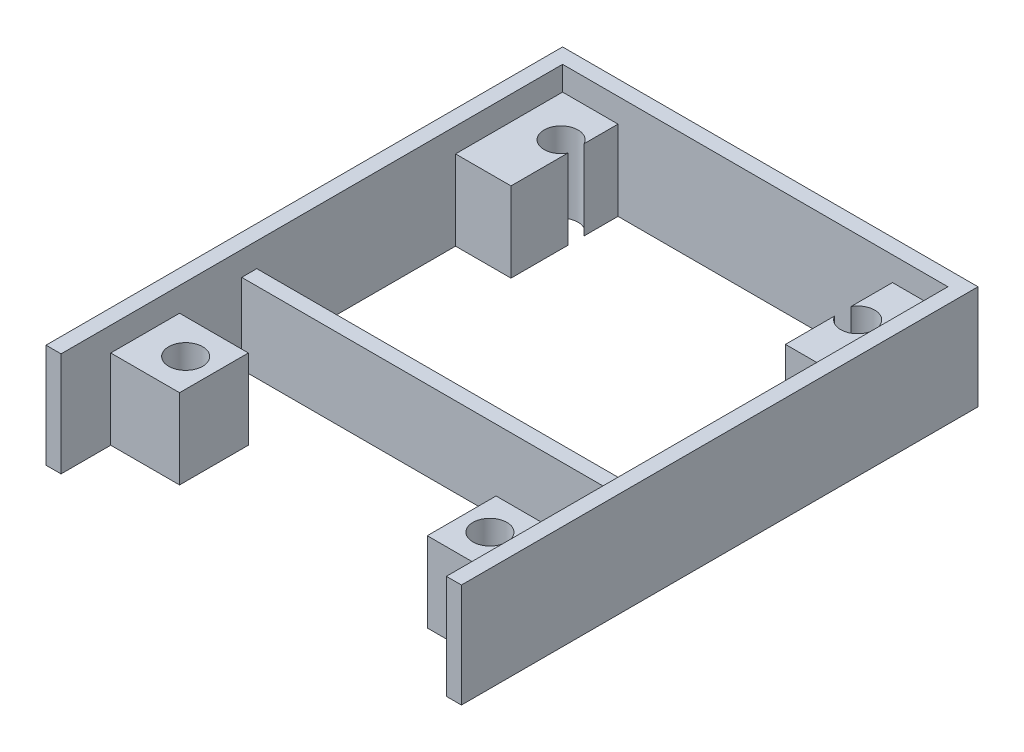
from build123d import *

# Parameters (mm, degrees)
SKETCH1_W            = 27.6032
SKETCH1_H            = 35.3248
SKETCH1_W_2          = 25.6032
SKETCH1_H_2          = 33.3248
MAINCASING_DEPTH     = 12.93
SKETCH2_W            = 6.35
SKETCH2_H            = 9.525
SKETCH2_R            = 1.4732
MOUNTINGTABS_DEPTH   = 1.5875
SKETCH3_W            = 3.683
SKETCH3_H            = 7.112
SKETCH3_W_2          = 4.572
SKETCH3_H_2          = 4.572
SKETCH3_R            = 1.1303
BOSS_EXTRUDE3_DEPTH  = 12.93
SKETCH4_W            = 27.6032
SKETCH4_H            = 35.3248
SKETCH4_W_2          = 25.6032
SKETCH4_H_2          = 33.3248
BOSS_EXTRUDE4_DEPTH  = 1.6002
SKETCH5_R            = 1.1303
UPPERHOLES_DEPTH     = 38.848662667
SKETCH6_W            = 25.6032
SKETCH6_H            = 1
BOSS_EXTRUDE5_DEPTH  = 12.93
SKETCH7_W            = 27.6032
SKETCH7_H            = 1
CUT_EXTRUDE2_DEPTH   = 38.848662667
SKETCH8_W            = 47.196128447
SKETCH8_H            = 36.476203794
TEMPMATREMOVAL_DEPTH = 7.62


with BuildPart() as part:
    # Sketch1 → mainCasing (new body)
    with BuildSketch(Plane(origin=(0, 0, 0), x_dir=(1, 0, 0), z_dir=(0, 1, 0))):
        with Locations((2.873828571, -8.628742857)):
            Rectangle(SKETCH1_W, SKETCH1_H)
        with Locations((2.873828571, -8.628742857)):
            Rectangle(SKETCH1_W_2, SKETCH1_H_2, mode=Mode.SUBTRACT)
    extrude(amount=-MAINCASING_DEPTH)

    # Sketch2 → mountingTabs (add)
    # profile 1 of 2: a face of its own
    with BuildSketch(Plane.XZ.offset(12.93)):
        with Locations((-14.102771429, 8.628742857)):
            Rectangle(SKETCH2_W, SKETCH2_H)
        with Locations(Location((-14.102771429, 8.628742857, 0), (0, 0, 270))):
            Circle(SKETCH2_R, mode=Mode.SUBTRACT)
    # profile 2 of 2: a face of its own
    with BuildSketch(Plane.XZ.offset(12.93)):
        with Locations((19.850428571, 8.628742857)):
            Rectangle(SKETCH2_W, SKETCH2_H)
        with Locations(Location((19.850428571, 8.628742857, 0), (0, 0, 270))):
            Circle(SKETCH2_R, mode=Mode.SUBTRACT)
    extrude(amount=-MOUNTINGTABS_DEPTH)

    # Sketch3 → Boss-Extrude3 (add)
    # profile 1 of 4: a face of its own
    with BuildSketch(Plane(origin=(0, 0, 0), x_dir=(1, 0, 0), z_dir=(0, 1, 0))):
        with Locations((-8.086271429, 4.477657143)):
            Rectangle(SKETCH3_W, SKETCH3_H)
    # profile 2 of 4: a face of its own
    with BuildSketch(Plane(origin=(0, 0, 0), x_dir=(1, 0, 0), z_dir=(0, 1, 0))):
        with Locations((13.833928571, 4.477657143)):
            Rectangle(SKETCH3_W, SKETCH3_H)
    # profile 3 of 4: a face of its own
    with BuildSketch(Plane(origin=(0, 0, 0), x_dir=(1, 0, 0), z_dir=(0, 1, 0))):
        with Locations((-7.641771429, -19.703142857)):
            Rectangle(SKETCH3_W_2, SKETCH3_H_2)
        with Locations(Location((-7.235371429, -19.703142857, 0), (0, 0, 270))):
            Circle(SKETCH3_R, mode=Mode.SUBTRACT)
    # profile 4 of 4: a face of its own
    with BuildSketch(Plane(origin=(0, 0, 0), x_dir=(1, 0, 0), z_dir=(0, 1, 0))):
        with Locations((13.389428571, -19.703142857)):
            Rectangle(SKETCH3_W_2, SKETCH3_H_2)
        with Locations(Location((12.983028571, -19.703142857, 0), (0, 0, 270))):
            Circle(SKETCH3_R, mode=Mode.SUBTRACT)
    extrude(amount=-BOSS_EXTRUDE3_DEPTH)

    # Sketch4 → Boss-Extrude4 (add)
    with BuildSketch(Plane(origin=(0, 0, 0), x_dir=(1, 0, 0), z_dir=(0, 1, 0))):
        with Locations((2.873828571, -8.628742857)):
            Rectangle(SKETCH4_W, SKETCH4_H)
        with Locations((2.873828571, -8.628742857)):
            Rectangle(SKETCH4_W_2, SKETCH4_H_2, mode=Mode.SUBTRACT)
    extrude(amount=BOSS_EXTRUDE4_DEPTH)

    # Sketch5 → upperHoles (cut, through all)
    with BuildSketch(Plane.XZ.offset(12.93)):
        with Locations((-7.235371429, -5.239657143)):
            Circle(SKETCH5_R)
        with Locations((12.983028571, -4.731657143)):
            Circle(SKETCH5_R)
    extrude(amount=-UPPERHOLES_DEPTH, mode=Mode.SUBTRACT)

    # Sketch6 → Boss-Extrude5 (add)
    with BuildSketch(Plane.XZ.offset(12.93)):
        with Locations((2.873828571, 12.786342857)):
            Rectangle(SKETCH6_W, SKETCH6_H)
    extrude(amount=-BOSS_EXTRUDE5_DEPTH)

    # Sketch7 → Cut-Extrude2 (cut, through all)
    with BuildSketch(Plane.XZ.offset(12.93)):
        with Locations((2.873828571, 25.791142857)):
            Rectangle(SKETCH7_W, SKETCH7_H)
    extrude(amount=-CUT_EXTRUDE2_DEPTH, mode=Mode.SUBTRACT)

    # Sketch8 → tempMatRemoval (cut)
    with BuildSketch(Plane.XZ.offset(12.93)):
        with Locations((2.61294545, 8.081309562)):
            Rectangle(SKETCH8_W, SKETCH8_H)
    extrude(amount=-TEMPMATREMOVAL_DEPTH, mode=Mode.SUBTRACT)


solid = part.part
